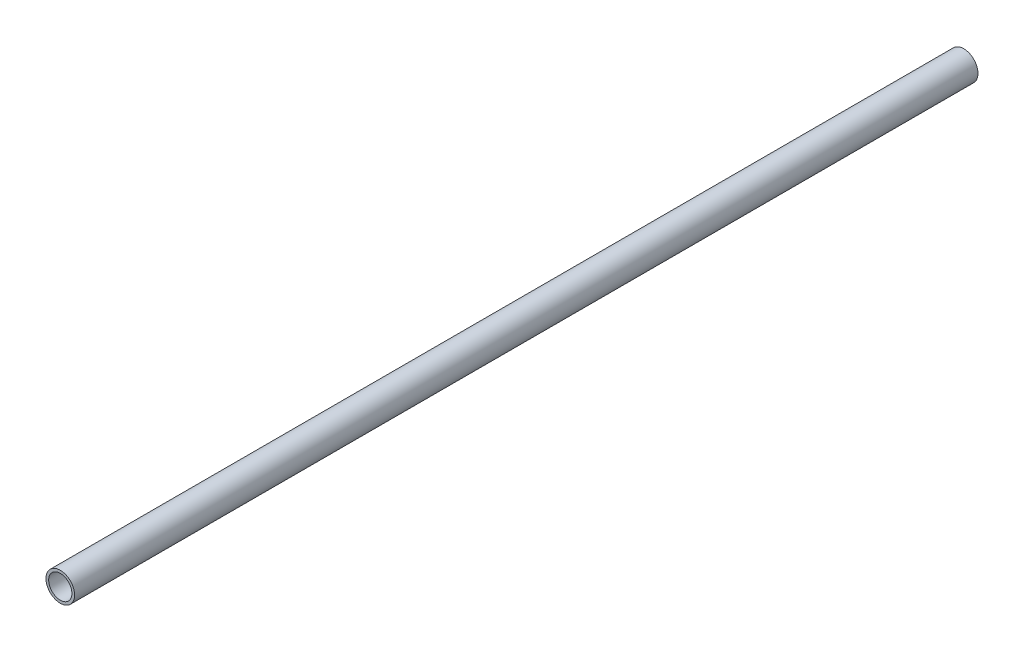
from build123d import *

# Parameters (mm, degrees)
CROQUIS1_R     = 16
EXTRUIR1_DEPTH = 505
VACIADO1_T     = -3


with BuildPart() as part:
    # Croquis1 → Extruir1 (new, symmetric)
    with BuildSketch(Plane.XY):
        Circle(CROQUIS1_R)
    extrude(amount=EXTRUIR1_DEPTH, both=True)

    # Vaciado1
    vaciado1_openings = [part.faces().sort_by_distance(p)[0] for p in [
        (0, 0, 505),
        (0, 0, -505),
    ]]
    offset(amount=VACIADO1_T, openings=vaciado1_openings, kind=Kind.INTERSECTION)


solid = part.part
